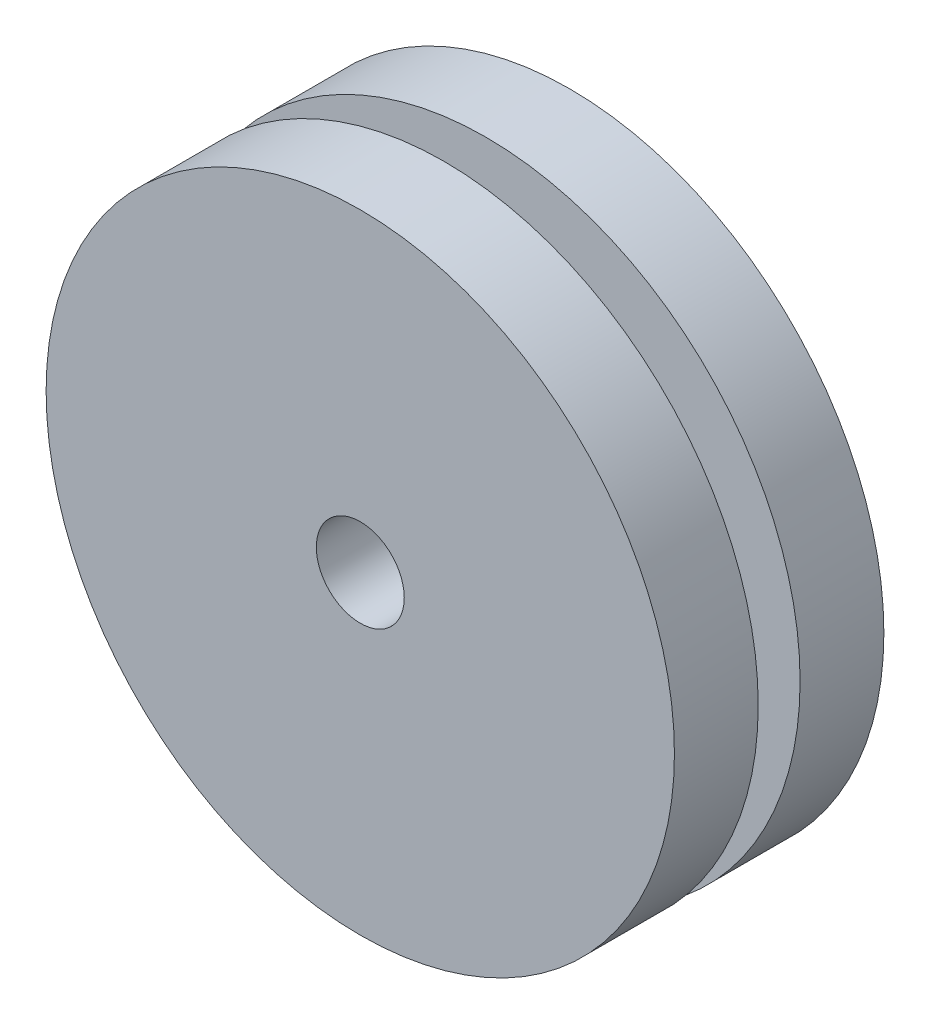
from build123d import *

# Parameters (mm, degrees)
SKETCH1_R           = 19.05
BOSS_EXTRUDE1_DEPTH = 12.7
SKETCH2_W           = 12.7
SKETCH2_H           = 2.54
SKETCH3_R           = 2.667
CUT_EXTRUDE1_DEPTH  = 30.784140075
BOSS_EXTRUDE2_DEPTH = 2.54
BOSS_EXTRUDE2_TAPER = 20
CIRPATTERN1_COUNT   = 6


with BuildPart() as part:
    # Sketch1 → Boss-Extrude1 (new body)
    with BuildSketch(Plane.XY):
        Circle(SKETCH1_R)
    extrude(amount=BOSS_EXTRUDE1_DEPTH)

    # Sketch2 → Cut-Revolve1 (revolve, cut)
    with BuildSketch(Plane(origin=(0, 0, 0), x_dir=(1, 0, 0), z_dir=(0, 1, 0)), mode=Mode.PRIVATE) as cut_revolve1_sk:
        with Locations((12.7, -6.35)):
            Rectangle(SKETCH2_W, SKETCH2_H)
    revolve(cut_revolve1_sk.sketch.rotate(Axis((0, 0, 0), (0, 0, 1)), 180), axis=Axis((0, 0, 0), (0, 0, 1)), mode=Mode.SUBTRACT)

    # Sketch3 → Cut-Extrude1 (cut, through all)
    with BuildSketch(Plane.XY.offset(12.7)):
        Circle(SKETCH3_R)
    extrude(amount=-CUT_EXTRUDE1_DEPTH, mode=Mode.SUBTRACT)

    # Sketch4 → Boss-Extrude2 (add)
    with BuildSketch(Plane(origin=(0, 0, 0), x_dir=(-1, 0, 0), z_dir=(0, 0, -1))):
        Polygon((-4.445, 3.050443212), (-2.54, 6.35), (-4.445, 9.649556788), (-8.255, 9.649556788), (-10.16, 6.35), (-8.255, 3.050443212), align=None)
    boss_extrude2 = extrude(amount=BOSS_EXTRUDE2_DEPTH, taper=BOSS_EXTRUDE2_TAPER)

    # CirPattern1: Boss-Extrude2 ×6 about axis
    cirpattern1_axis = Axis((0, 0, 0), (0, 0, 1))
    for i in range(1, CIRPATTERN1_COUNT):
        add(boss_extrude2.rotate(cirpattern1_axis, i * 360 / CIRPATTERN1_COUNT))


solid = part.part
